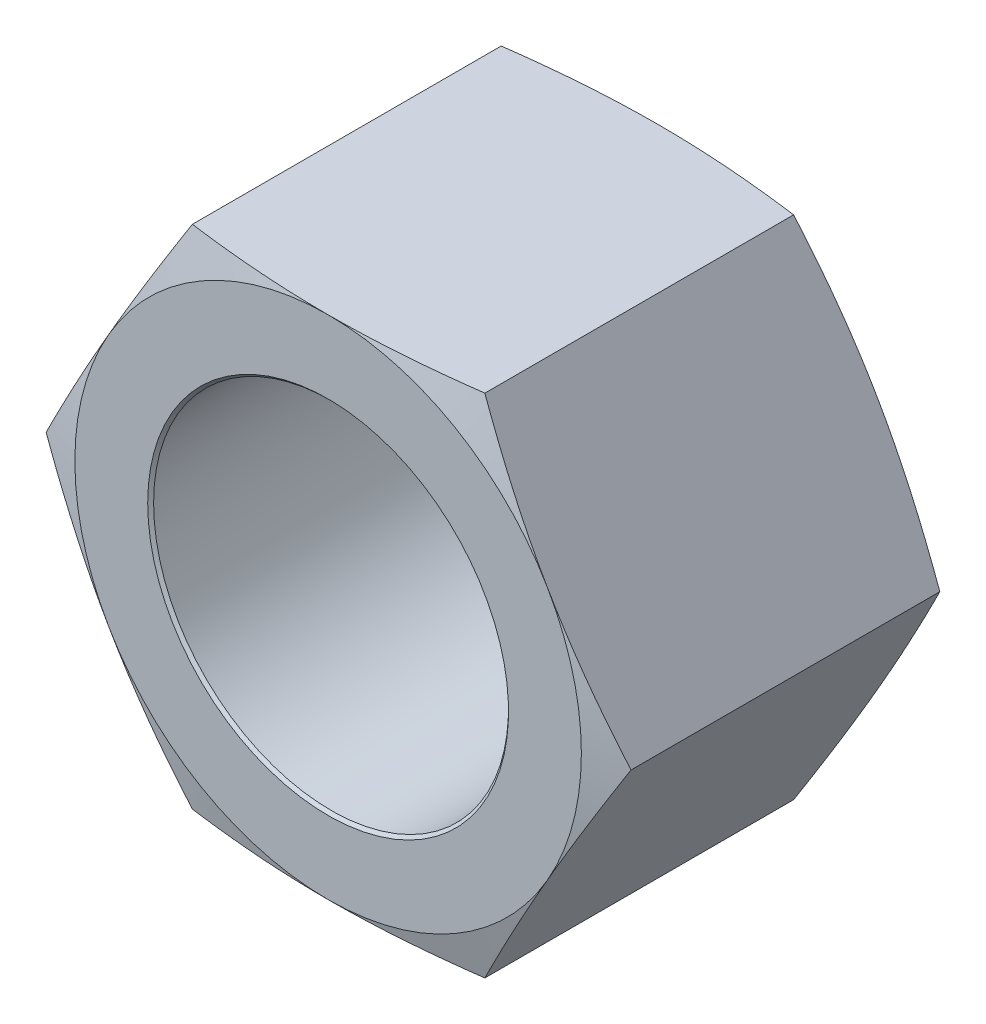
from build123d import *

# Parameters (mm, degrees)
SKETCH_1_R          = 12
EXTRUDE_522_DEPTH   = 22.3
SKETCH_2_OUTSIDE_W  = 336.56
SKETCH_2_OUTSIDE_H  = 331.262
SKETCH_2_OUTSIDE_R  = 17.12565236
CUT_EXTRUDE_1_DEPTH = 38
CUT_EXTRUDE_1_DRAFT = -75
SKETCH_3_OUTSIDE_W  = 336.56
SKETCH_3_OUTSIDE_H  = 331.262
SKETCH_3_OUTSIDE_R  = 17.12565236
CUT_EXTRUDE_2_DEPTH = 38
CUT_EXTRUDE_2_DRAFT = -75
CHAMFER_1_SIZE      = 0.2


with BuildPart() as part:
    # 草图1 → Extrude 522 (new body)
    with BuildSketch(Plane.XY):
        Polygon((9.8875, 17.12565236), (-9.8875, 17.12565236), (-19.775, 0), (-9.8875, -17.12565236), (9.8875, -17.12565236), (19.775, 0), align=None)
        Circle(SKETCH_1_R, mode=Mode.SUBTRACT)
    extrude(amount=EXTRUDE_522_DEPTH)


with BuildPart() as cut_extrude_1_tool:
    # 草图2 outside → 切除-拉伸1 (with draft: the straight prism first)
    with BuildSketch(Plane(origin=(0, 0, 0), x_dir=(-1, 0, 0), z_dir=(0, 0, -1))):
        Rectangle(SKETCH_2_OUTSIDE_W, SKETCH_2_OUTSIDE_H)
        Circle(SKETCH_2_OUTSIDE_R, mode=Mode.SUBTRACT)
    extrude(amount=-CUT_EXTRUDE_1_DEPTH)
    # 切除-拉伸1: the draft: its side faces are tilted about the plane it starts from
    cut_extrude_1_sides = [cut_extrude_1_tool.faces().sort_by_distance(p)[0] for p in [
        (0, -165.631, 19),
        (-168.28, 0, 19),
        (0, 165.631, 19),
        (168.28, 0, 19),
        (17.12565236, 0, 19),
    ]]
    draft(cut_extrude_1_sides, Plane(origin=(0, 0, 0), x_dir=(-1, 0, 0), z_dir=(0, 0, -1)), CUT_EXTRUDE_1_DRAFT)


with BuildPart() as part_1:
    add(part.part)

    # 切除-拉伸1: cut by cut_extrude_1_tool
    add(cut_extrude_1_tool.part, mode=Mode.SUBTRACT)


with BuildPart() as cut_extrude_2_tool:
    # 草图3 outside → 切除-拉伸2 (with draft: the straight prism first)
    with BuildSketch(Plane.XY.offset(22.3)):
        Rectangle(SKETCH_3_OUTSIDE_W, SKETCH_3_OUTSIDE_H)
        Circle(SKETCH_3_OUTSIDE_R, mode=Mode.SUBTRACT)
    extrude(amount=-CUT_EXTRUDE_2_DEPTH)
    # 切除-拉伸2: the draft: its side faces are tilted about the plane it starts from
    cut_extrude_2_sides = [cut_extrude_2_tool.faces().sort_by_distance(p)[0] for p in [
        (0, -165.631, 3.3),
        (168.28, 0, 3.3),
        (0, 165.631, 3.3),
        (-168.28, 0, 3.3),
        (-17.12565236, 0, 3.3),
    ]]
    draft(cut_extrude_2_sides, Plane.XY.offset(22.3), CUT_EXTRUDE_2_DRAFT)


with BuildPart() as part_2:
    add(part_1.part)

    # 切除-拉伸2: cut by cut_extrude_2_tool
    add(cut_extrude_2_tool.part, mode=Mode.SUBTRACT)

    # 倒角1
    chamfer_1_edges = [part_2.edges().sort_by_distance(p)[0] for p in [
        (-12, 0, 0),
        (-12, 0, 22.3),
    ]]
    chamfer(chamfer_1_edges, length=CHAMFER_1_SIZE)


solid = part_2.part
